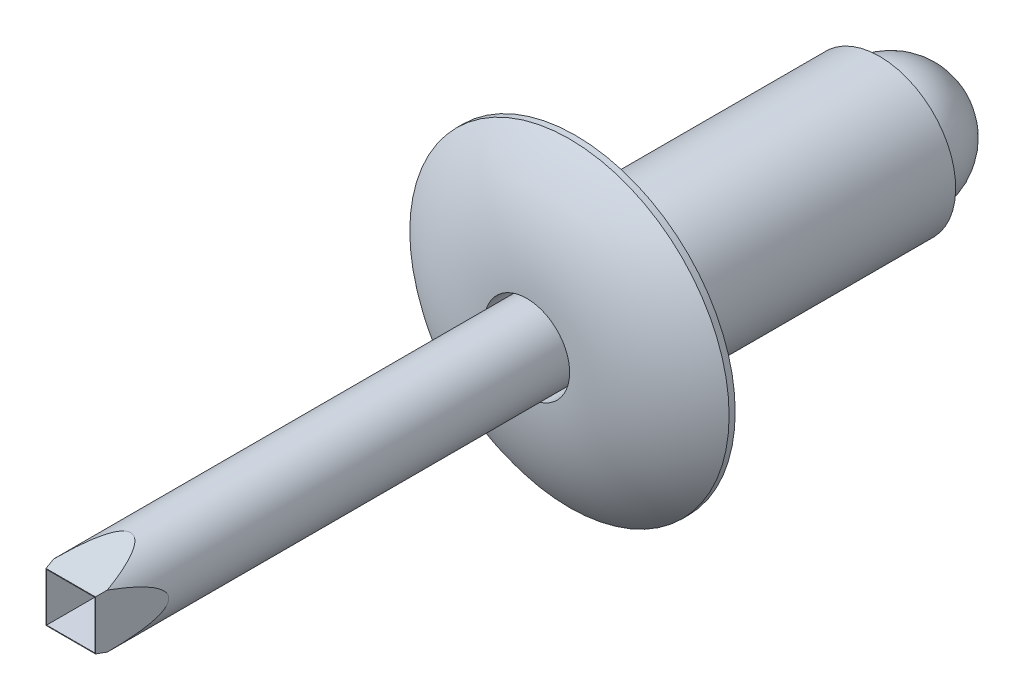
from build123d import *

# Parameters (mm, degrees)
SKETCH7_W          = 22.352
SKETCH7_H          = 1.5875
CUT_EXTRUDE1_DEPTH = 24.094627929
CIRPATTERN1_COUNT  = 2
CIRPATTERN1_ANGLE  = 90
SKETCH9_W          = 2.01295
SKETCH9_H          = 2.01295
CUT_EXTRUDE3_DEPTH = 2.54
FILLET2_R          = 0.254


with BuildPart() as part:
    # Sketch2 → Revolve1 (revolve)
    with BuildSketch(Plane(origin=(0, 0, 0), x_dir=(0, 0, -1), z_dir=(1, 0, 0))):
        with BuildLine():
            Line((12.7, 3.175), (0, 3.175))
            Line((0, 3.175), (0, 6.6675))
            Line((0, 6.6675), (-0.254, 6.6675))
            ThreePointArc((-0.254, 6.6675), (-1.573661586, 4.383577604), (-2.032, 1.7859375))
            Line((-2.032, 1.7859375), (0, 1.7859375))
            Line((0, 1.7859375), (1.27, 1.7859375))
            Line((1.27, 1.7859375), (1.27, 0))
            Line((1.27, 0), (12.7, 0))
            Line((12.7, 0), (12.7, 3.175))
        make_face()
    revolve(axis=Axis((0, 0, -12.7), (0, 0, 1)))

    # Fillet2
    fillet2_edges = [part.edges().sort_by_distance(p)[0] for p in [
        (0, -3.175, 0),
    ]]
    fillet(fillet2_edges, radius=FILLET2_R)


with BuildPart() as body_2:
    # Sketch7 → Revolve2 (revolve)
    with BuildSketch(Plane(origin=(0, 0, 0), x_dir=(0, 0, -1), z_dir=(1, 0, 0)), mode=Mode.PRIVATE) as revolve2_sk:
        with Locations((-9.906, 0.79375)):
            Rectangle(SKETCH7_W, SKETCH7_H)
    revolve(revolve2_sk.sketch.rotate(Axis((0, 0, 21.082), (0, 0, -1)), 90), axis=Axis((0, 0, 21.082), (0, 0, -1)))

    # Sketch3 → Cut-Extrude1 (cut, symmetric)
    with BuildSketch(Plane(origin=(0, 0, 0), x_dir=(1, 0, 0), z_dir=(0, 1, 0))):
        Polygon((-1.7907, -17.65916162), (-1.031875, -21.082), (1.031875, -21.082), (1.7907, -17.65916162), (1.7907, -21.59), (-1.7907, -21.59), align=None)
    cut_extrude1 = extrude(amount=CUT_EXTRUDE1_DEPTH, both=True, mode=Mode.SUBTRACT)

    # CirPattern1: Cut-Extrude1 ×2 about axis
    cirpattern1_axis = Axis((0, 0, 21.082), (0, 0, -1))
    for i in range(1, CIRPATTERN1_COUNT):
        add(cut_extrude1.rotate(cirpattern1_axis, i * CIRPATTERN1_ANGLE / (CIRPATTERN1_COUNT - 1)), mode=Mode.SUBTRACT)

    # Sketch9 → Cut-Extrude3 (cut)
    with BuildSketch(Plane.XY.offset(21.082)):
        Rectangle(SKETCH9_W, SKETCH9_H)
    extrude(amount=-CUT_EXTRUDE3_DEPTH, mode=Mode.SUBTRACT)


with BuildPart() as body_3:
    # Sketch8 → Revolve3 (revolve)
    with BuildSketch(Plane(origin=(0, 0, 0), x_dir=(0, 0, -1), z_dir=(1, 0, 0))):
        with BuildLine():
            Line((12.7, 2.54), (12.7, 0))
            Line((12.7, 0), (15.748, 0))
            ThreePointArc((15.748, 0), (14.818836181, 1.983803418), (12.7, 2.54))
        make_face()
    revolve(axis=Axis((0, 0, -12.7), (0, 0, -1)))


solid = Compound([part.part, body_2.part, body_3.part])
